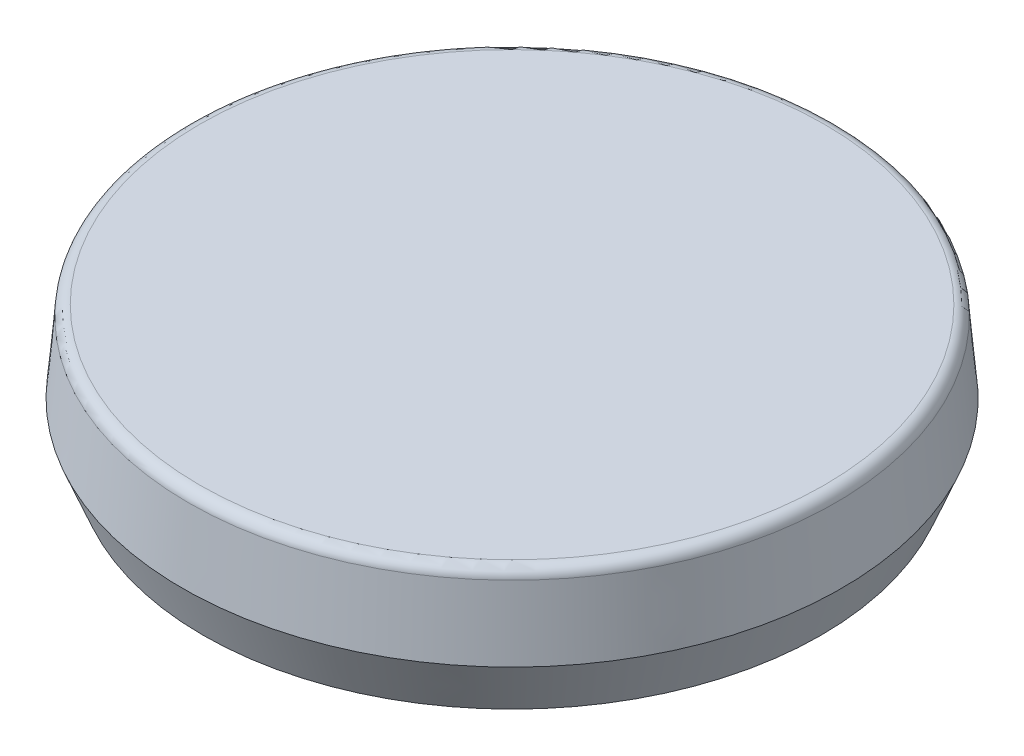
from build123d import *

# Parameters (mm, degrees)
FILLET1_R          = 0.1
SKETCH2_R          = 2.5
CUT_EXTRUDE1_DEPTH = 0.5


with BuildPart() as part:
    # Sketch1 → Revolve1 (revolve)
    with BuildSketch(Plane.XY, mode=Mode.PRIVATE) as revolve1_sk:
        Polygon((0, 0), (0, 1.2), (2.935572642, 1.2), (3, 0.463591927), (2.812696703, 0), align=None)
    revolve(revolve1_sk.sketch.rotate(Axis((0, 0, 0), (0, 1, 0)), 90), axis=Axis((0, 0, 0), (0, 1, 0)))

    # Fillet1
    fillet1_edges = [part.edges().sort_by_distance(p)[0] for p in [
        (0, 1.2, 2.935572642),
    ]]
    fillet(fillet1_edges, radius=FILLET1_R)

    # Sketch2 → Cut-Extrude1 (cut)
    with BuildSketch(Plane.XZ):
        with Locations(Location((0, 0, 0), (0, 0, 270))):
            Circle(SKETCH2_R)
    extrude(amount=-CUT_EXTRUDE1_DEPTH, mode=Mode.SUBTRACT)


solid = part.part
